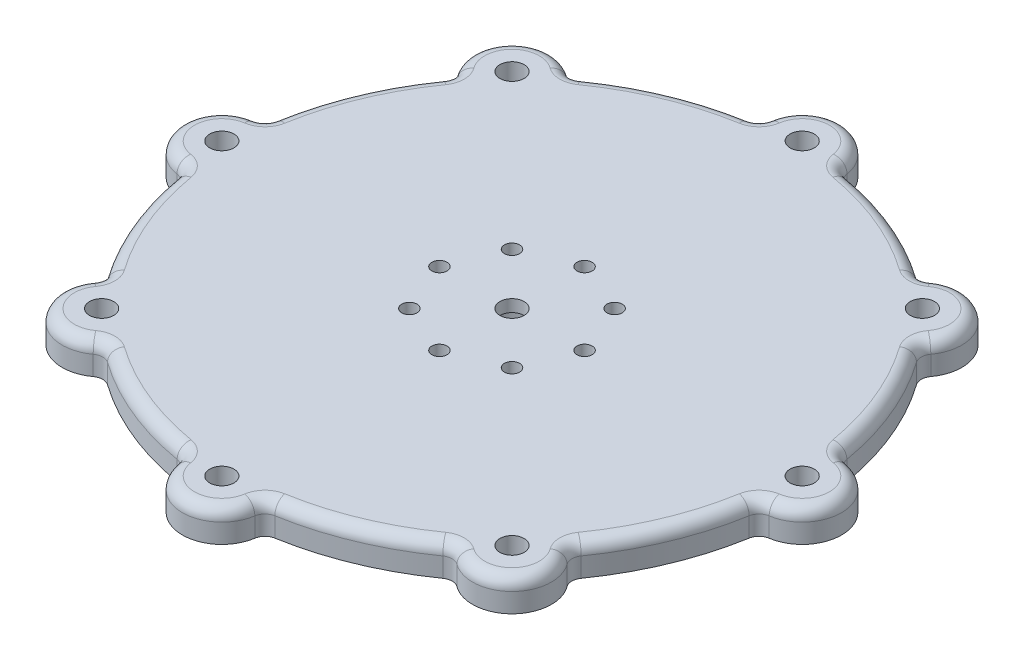
from build123d import *

# Parameters (mm, degrees)
SKETCH1_R           = 2.000000064
SKETCH1_R_2         = 7.9375
BOSS_EXTRUDE1_DEPTH = 5.08
SKETCH2_R           = 2.000000064
SKETCH2_R_2         = 3.175
BOSS_EXTRUDE2_DEPTH = 3.175
FILLET1_R           = 3.175


with BuildPart() as part:
    # Sketch1 → Boss-Extrude1 (new body)
    with BuildSketch(Plane(origin=(0, 0, 0), x_dir=(1, 0, 0), z_dir=(0, 1, 0))):
        with BuildLine():
            ThreePointArc((-10.231491372, 77.761756808), (-11.105207378, 76.015825656), (-12.835331785, 75.111212598))
            ThreePointArc((-12.835331785, 75.111212598), (-29.160477546, 70.399620377), (-44.035697628, 62.187597915))
            ThreePointArc((-44.035697628, 62.187597915), (-45.898738355, 61.603873243), (-47.751108625, 62.220622487))
            ThreePointArc((-47.751108625, 62.220622487), (-61.200091912, 61.200091912), (-62.220622487, 47.751108625))
            ThreePointArc((-62.220622487, 47.751108625), (-61.603873243, 45.898738355), (-62.187597915, 44.035697628))
            ThreePointArc((-62.187597915, 44.035697628), (-70.399620377, 29.160477546), (-75.111212598, 12.835331785))
            ThreePointArc((-75.111212598, 12.835331785), (-76.015825656, 11.105207378), (-77.761756808, 10.231491372))
            ThreePointArc((-77.761756808, 10.231491372), (-86.550000001, 0), (-77.761756808, -10.231491372))
            ThreePointArc((-77.761756808, -10.231491372), (-76.015825656, -11.105207378), (-75.111212598, -12.835331785))
            ThreePointArc((-75.111212598, -12.835331785), (-70.399620377, -29.160477546), (-62.187597915, -44.035697628))
            ThreePointArc((-62.187597915, -44.035697628), (-61.603873243, -45.898738355), (-62.220622487, -47.751108625))
            ThreePointArc((-62.220622487, -47.751108625), (-61.200091912, -61.200091912), (-47.751108625, -62.220622487))
            ThreePointArc((-47.751108625, -62.220622487), (-45.898738355, -61.603873243), (-44.035697628, -62.187597915))
            ThreePointArc((-44.035697628, -62.187597915), (-29.160477546, -70.399620377), (-12.835331785, -75.111212598))
            ThreePointArc((-12.835331785, -75.111212598), (-11.105207378, -76.015825656), (-10.231491372, -77.761756808))
            ThreePointArc((-10.231491372, -77.761756808), (0, -86.550000001), (10.231491372, -77.761756808))
            ThreePointArc((10.231491372, -77.761756808), (11.105207378, -76.015825656), (12.835331785, -75.111212598))
            ThreePointArc((12.835331785, -75.111212598), (29.160477546, -70.399620377), (44.035697628, -62.187597915))
            ThreePointArc((44.035697628, -62.187597915), (45.898738355, -61.603873243), (47.751108625, -62.220622487))
            ThreePointArc((47.751108625, -62.220622487), (61.200091912, -61.200091912), (62.220622487, -47.751108625))
            ThreePointArc((62.220622487, -47.751108625), (61.603873243, -45.898738355), (62.187597915, -44.035697628))
            ThreePointArc((62.187597915, -44.035697628), (70.399620377, -29.160477546), (75.111212598, -12.835331785))
            ThreePointArc((75.111212598, -12.835331785), (76.015825656, -11.105207378), (77.761756808, -10.231491372))
            ThreePointArc((77.761756808, -10.231491372), (86.550000001, 0), (77.761756808, 10.231491372))
            ThreePointArc((77.761756808, 10.231491372), (76.015825656, 11.105207378), (75.111212598, 12.835331785))
            ThreePointArc((75.111212598, 12.835331785), (70.399620377, 29.160477546), (62.187597915, 44.035697628))
            ThreePointArc((62.187597915, 44.035697628), (61.603873243, 45.898738355), (62.220622487, 47.751108625))
            ThreePointArc((62.220622487, 47.751108625), (61.200091912, 61.200091912), (47.751108625, 62.220622487))
            ThreePointArc((47.751108625, 62.220622487), (45.898738355, 61.603873243), (44.035697628, 62.187597915))
            ThreePointArc((44.035697628, 62.187597915), (29.160477546, 70.399620377), (12.835331785, 75.111212598))
            ThreePointArc((12.835331785, 75.111212598), (11.105207378, 76.015825656), (10.231491372, 77.761756808))
            ThreePointArc((10.231491372, 77.761756808), (0, 86.550000001), (-10.231491372, 77.761756808))
        make_face()
        with BuildLine():
            ThreePointArc((-50.706536726, -53.881536726), (-55.127047745, -56.802037934), (-56.079341326, -51.590187792))
            ThreePointArc((-56.079341326, -51.590187792), (-52.636025708, -50.961035519), (-50.706536726, -53.881536726))
        make_face(mode=Mode.SUBTRACT)
        with BuildLine():
            ThreePointArc((3.175, -76.2), (-0.033074711, -79.374827722), (-3.174310906, -76.133854167))
            ThreePointArc((-3.174310906, -76.133854167), (0.033074711, -73.025172278), (3.175, -76.2))
        make_face(mode=Mode.SUBTRACT)
        with Locations(Location((-13.470384182, -13.470384182, 0), (0, 0, 270))):
            Circle(SKETCH1_R, mode=Mode.SUBTRACT)
        with BuildLine():
            ThreePointArc((57.056536726, -53.881536726), (55.065933647, -56.827352222), (51.590187792, -56.079341326))
            ThreePointArc((51.590187792, -56.079341326), (52.697139805, -50.935721231), (57.056536726, -53.881536726))
        make_face(mode=Mode.SUBTRACT)
        with Locations(Location((0, -19.05, 0), (0, 0, 270))):
            Circle(SKETCH1_R, mode=Mode.SUBTRACT)
        with Locations(Location((13.470384182, -13.470384182, 0), (0, 0, 270))):
            Circle(SKETCH1_R, mode=Mode.SUBTRACT)
        with Locations(Location((19.05, 0, 0), (0, 0, 270))):
            Circle(SKETCH1_R, mode=Mode.SUBTRACT)
        with BuildLine():
            ThreePointArc((79.375, 0), (78.421554859, -2.268329564), (76.133854167, -3.174310906))
            ThreePointArc((76.133854167, -3.174310906), (73.978445141, 2.268329564), (79.375, 0))
        make_face(mode=Mode.SUBTRACT)
        with BuildLine():
            ThreePointArc((-73.025, 0), (-78.468329564, -2.221554859), (-76.133854167, 3.174310906))
            ThreePointArc((-76.133854167, 3.174310906), (-73.931670436, 2.221554859), (-73.025, 0))
        make_face(mode=Mode.SUBTRACT)
        with Locations(Location((-19.05, 0, 0), (0, 0, 270))):
            Circle(SKETCH1_R, mode=Mode.SUBTRACT)
        with Locations(Location((-13.470384182, 13.470384182, 0), (0, 0, 270))):
            Circle(SKETCH1_R, mode=Mode.SUBTRACT)
        with BuildLine():
            ThreePointArc((-50.706536726, 53.881536726), (-56.827352222, 52.697139805), (-51.590187792, 56.079341326))
            ThreePointArc((-51.590187792, 56.079341326), (-50.935721231, 55.065933647), (-50.706536726, 53.881536726))
        make_face(mode=Mode.SUBTRACT)
        with Locations(Location((0, 0, 0), (0, 0, 270))):
            Circle(SKETCH1_R_2, mode=Mode.SUBTRACT)
        with Locations(Location((0, 19.05, 0), (0, 0, 270))):
            Circle(SKETCH1_R, mode=Mode.SUBTRACT)
        with Locations(Location((13.470384182, 13.470384182, 0), (0, 0, 270))):
            Circle(SKETCH1_R, mode=Mode.SUBTRACT)
        with BuildLine():
            ThreePointArc((3.175, 76.2), (3.174827722, 76.166925289), (3.174310906, 76.133854167))
            ThreePointArc((3.174310906, 76.133854167), (-3.174827722, 76.233074711), (3.175, 76.2))
        make_face(mode=Mode.SUBTRACT)
        with BuildLine():
            ThreePointArc((57.056536726, 53.881536726), (56.802037934, 52.636025708), (56.079341326, 51.590187792))
            ThreePointArc((56.079341326, 51.590187792), (50.961035519, 55.127047745), (57.056536726, 53.881536726))
        make_face(mode=Mode.SUBTRACT)
    extrude(amount=BOSS_EXTRUDE1_DEPTH)

    # Sketch2 → Boss-Extrude2 (add)
    with BuildSketch(Plane(origin=(0, 5.08, 0), x_dir=(1, 0, 0), z_dir=(0, 1, 0))):
        with BuildLine():
            ThreePointArc((44.035697628, 62.187597915), (29.160477546, 70.399620377), (12.835331785, 75.111212598))
            ThreePointArc((12.835331785, 75.111212598), (11.105207378, 76.015825656), (10.231491372, 77.761756808))
            ThreePointArc((10.231491372, 77.761756808), (0, 86.550000001), (-10.231491372, 77.761756808))
            ThreePointArc((-10.231491372, 77.761756808), (-11.105207378, 76.015825656), (-12.835331785, 75.111212598))
            ThreePointArc((-12.835331785, 75.111212598), (-29.160477546, 70.399620377), (-44.035697628, 62.187597915))
            ThreePointArc((-44.035697628, 62.187597915), (-45.898738355, 61.603873243), (-47.751108625, 62.220622487))
            ThreePointArc((-47.751108625, 62.220622487), (-61.200091912, 61.200091912), (-62.220622487, 47.751108625))
            ThreePointArc((-62.220622487, 47.751108625), (-61.603873243, 45.898738355), (-62.187597915, 44.035697628))
            ThreePointArc((-62.187597915, 44.035697628), (-70.399620377, 29.160477546), (-75.111212598, 12.835331785))
            ThreePointArc((-75.111212598, 12.835331785), (-76.015825656, 11.105207378), (-77.761756808, 10.231491372))
            ThreePointArc((-77.761756808, 10.231491372), (-86.550000001, 0), (-77.761756808, -10.231491372))
            ThreePointArc((-77.761756808, -10.231491372), (-76.015825656, -11.105207378), (-75.111212598, -12.835331785))
            ThreePointArc((-75.111212598, -12.835331785), (-70.399620377, -29.160477546), (-62.187597915, -44.035697628))
            ThreePointArc((-62.187597915, -44.035697628), (-61.603873243, -45.898738355), (-62.220622487, -47.751108625))
            ThreePointArc((-62.220622487, -47.751108625), (-61.200091912, -61.200091912), (-47.751108625, -62.220622487))
            ThreePointArc((-47.751108625, -62.220622487), (-45.898738355, -61.603873243), (-44.035697628, -62.187597915))
            ThreePointArc((-44.035697628, -62.187597915), (-29.160477546, -70.399620377), (-12.835331785, -75.111212598))
            ThreePointArc((-12.835331785, -75.111212598), (-11.105207378, -76.015825656), (-10.231491372, -77.761756808))
            ThreePointArc((-10.231491372, -77.761756808), (0, -86.550000001), (10.231491372, -77.761756808))
            ThreePointArc((10.231491372, -77.761756808), (11.105207378, -76.015825656), (12.835331785, -75.111212598))
            ThreePointArc((12.835331785, -75.111212598), (29.160477546, -70.399620377), (44.035697628, -62.187597915))
            ThreePointArc((44.035697628, -62.187597915), (45.898738355, -61.603873243), (47.751108625, -62.220622487))
            ThreePointArc((47.751108625, -62.220622487), (61.200091912, -61.200091912), (62.220622487, -47.751108625))
            ThreePointArc((62.220622487, -47.751108625), (61.603873243, -45.898738355), (62.187597915, -44.035697628))
            ThreePointArc((62.187597915, -44.035697628), (70.399620377, -29.160477546), (75.111212598, -12.835331785))
            ThreePointArc((75.111212598, -12.835331785), (76.015825656, -11.105207378), (77.761756808, -10.231491372))
            ThreePointArc((77.761756808, -10.231491372), (86.550000001, 0), (77.761756808, 10.231491372))
            ThreePointArc((77.761756808, 10.231491372), (76.015825656, 11.105207378), (75.111212598, 12.835331785))
            ThreePointArc((75.111212598, 12.835331785), (70.399620377, 29.160477546), (62.187597915, 44.035697628))
            ThreePointArc((62.187597915, 44.035697628), (61.603873243, 45.898738355), (62.220622487, 47.751108625))
            ThreePointArc((62.220622487, 47.751108625), (61.200091912, 61.200091912), (47.751108625, 62.220622487))
            ThreePointArc((47.751108625, 62.220622487), (45.898738355, 61.603873243), (44.035697628, 62.187597915))
        make_face()
        with BuildLine():
            ThreePointArc((-50.706536726, -53.881536726), (-55.127047745, -56.802037934), (-56.079341326, -51.590187792))
            ThreePointArc((-56.079341326, -51.590187792), (-52.636025708, -50.961035519), (-50.706536726, -53.881536726))
        make_face(mode=Mode.SUBTRACT)
        with BuildLine():
            ThreePointArc((3.175, -76.2), (-0.033074711, -79.374827722), (-3.174310906, -76.133854167))
            ThreePointArc((-3.174310906, -76.133854167), (0.033074711, -73.025172278), (3.175, -76.2))
        make_face(mode=Mode.SUBTRACT)
        with Locations(Location((-13.470384182, -13.470384182, 0), (0, 0, 270))):
            Circle(SKETCH2_R, mode=Mode.SUBTRACT)
        with Locations(Location((0, -19.05, 0), (0, 0, 270))):
            Circle(SKETCH2_R, mode=Mode.SUBTRACT)
        with BuildLine():
            ThreePointArc((57.056536726, -53.881536726), (55.065933647, -56.827352222), (51.590187792, -56.079341326))
            ThreePointArc((51.590187792, -56.079341326), (52.697139805, -50.935721231), (57.056536726, -53.881536726))
        make_face(mode=Mode.SUBTRACT)
        with Locations(Location((13.470384182, -13.470384182, 0), (0, 0, 270))):
            Circle(SKETCH2_R, mode=Mode.SUBTRACT)
        with Locations(Location((19.05, 0, 0), (0, 0, 270))):
            Circle(SKETCH2_R, mode=Mode.SUBTRACT)
        with BuildLine():
            ThreePointArc((79.375, 0), (78.421554859, -2.268329564), (76.133854167, -3.174310906))
            ThreePointArc((76.133854167, -3.174310906), (73.978445141, 2.268329564), (79.375, 0))
        make_face(mode=Mode.SUBTRACT)
        with BuildLine():
            ThreePointArc((-73.025, 0), (-78.468329564, -2.221554859), (-76.133854167, 3.174310906))
            ThreePointArc((-76.133854167, 3.174310906), (-73.931670436, 2.221554859), (-73.025, 0))
        make_face(mode=Mode.SUBTRACT)
        with Locations(Location((-19.05, 0, 0), (0, 0, 270))):
            Circle(SKETCH2_R, mode=Mode.SUBTRACT)
        with Locations(Location((-13.470384182, 13.470384182, 0), (0, 0, 270))):
            Circle(SKETCH2_R, mode=Mode.SUBTRACT)
        with BuildLine():
            ThreePointArc((-50.706536726, 53.881536726), (-56.827352222, 52.697139805), (-51.590187792, 56.079341326))
            ThreePointArc((-51.590187792, 56.079341326), (-50.935721231, 55.065933647), (-50.706536726, 53.881536726))
        make_face(mode=Mode.SUBTRACT)
        with Locations(Location((0, 0, 0), (0, 0, 270))):
            Circle(SKETCH2_R_2, mode=Mode.SUBTRACT)
        with Locations(Location((0, 19.05, 0), (0, 0, 270))):
            Circle(SKETCH2_R, mode=Mode.SUBTRACT)
        with Locations(Location((13.470384182, 13.470384182, 0), (0, 0, 270))):
            Circle(SKETCH2_R, mode=Mode.SUBTRACT)
        with BuildLine():
            ThreePointArc((3.174310906, 76.133854167), (-3.174827722, 76.233074711), (3.175, 76.2))
            ThreePointArc((3.175, 76.2), (3.174827722, 76.166925289), (3.174310906, 76.133854167))
        make_face(mode=Mode.SUBTRACT)
        with BuildLine():
            ThreePointArc((57.056536726, 53.881536726), (56.802037934, 52.636025708), (56.079341326, 51.590187792))
            ThreePointArc((56.079341326, 51.590187792), (50.961035519, 55.127047745), (57.056536726, 53.881536726))
        make_face(mode=Mode.SUBTRACT)
    extrude(amount=BOSS_EXTRUDE2_DEPTH)

    # Fillet1
    fillet1_edges = [part.edges().sort_by_distance(p)[0] for p in [
        (-29.160477546, 8.255, -70.399620377),
        (-45.898738355, 8.255, -61.603873243),
        (-61.200091912, 8.255, -61.200091912),
        (-61.603873243, 8.255, -45.898738355),
        (-70.399620377, 8.255, -29.160477546),
        (-76.015825656, 8.255, -11.105207378),
        (-86.550000001, 8.255, 0),
        (-76.015825656, 8.255, 11.105207378),
        (-70.399620377, 8.255, 29.160477546),
        (-61.603873243, 8.255, 45.898738355),
        (-61.200091912, 8.255, 61.200091912),
        (-45.898738355, 8.255, 61.603873243),
        (-29.160477546, 8.255, 70.399620377),
        (-11.105207378, 8.255, 76.015825656),
        (0, 8.255, 86.550000001),
        (11.105207378, 8.255, 76.015825656),
        (29.160477546, 8.255, 70.399620377),
        (45.898738355, 8.255, 61.603873243),
        (61.200091912, 8.255, 61.200091912),
        (61.603873243, 8.255, 45.898738355),
        (70.399620377, 8.255, 29.160477546),
        (76.015825656, 8.255, 11.105207378),
        (86.550000001, 8.255, 0),
        (76.015825656, 8.255, -11.105207378),
        (70.399620377, 8.255, -29.160477546),
        (61.603873243, 8.255, -45.898738355),
        (61.200091912, 8.255, -61.200091912),
        (45.898738355, 8.255, -61.603873243),
        (29.160477546, 8.255, -70.399620377),
        (11.105207378, 8.255, -76.015825656),
        (0, 8.255, -86.550000001),
        (-11.105207378, 8.255, -76.015825656),
    ]]
    fillet(fillet1_edges, radius=FILLET1_R)


solid = part.part
